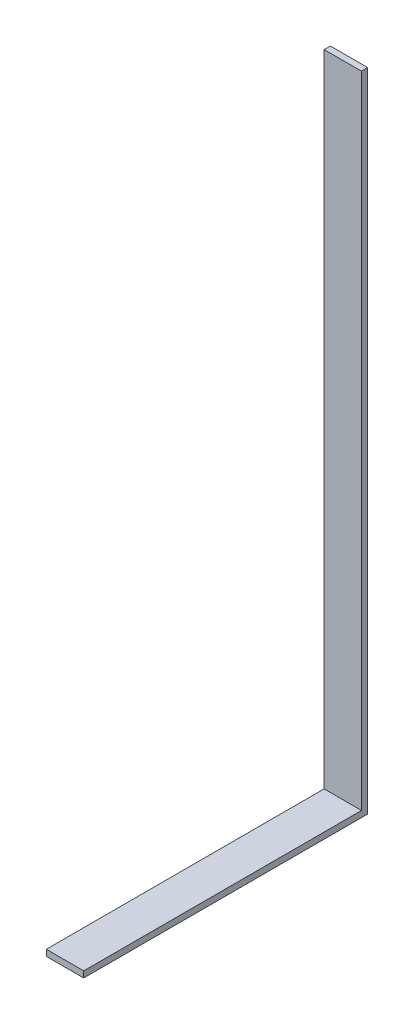
from build123d import *

# Parameters (mm, degrees)
CROQUIS1_W              = 38.1
CROQUIS1_H              = 6.31
SALIENTE_EXTRUIR1_DEPTH = 289.39
CROQUIS3_W              = 38.1
CROQUIS3_H              = 6.31
SALIENTE_EXTRUIR2_DEPTH = 658.79


with BuildPart() as part:
    # Croquis1 → Saliente-Extruir1 (new body)
    with BuildSketch(Plane.XY):
        Rectangle(CROQUIS1_W, CROQUIS1_H)
    extrude(amount=SALIENTE_EXTRUIR1_DEPTH)

    # Croquis3 → Saliente-Extruir2 (add)
    with BuildSketch(Plane.XZ.offset(3.155)):
        with Locations((0, 3.155)):
            Rectangle(CROQUIS3_W, CROQUIS3_H)
    extrude(amount=-SALIENTE_EXTRUIR2_DEPTH)


solid = part.part
